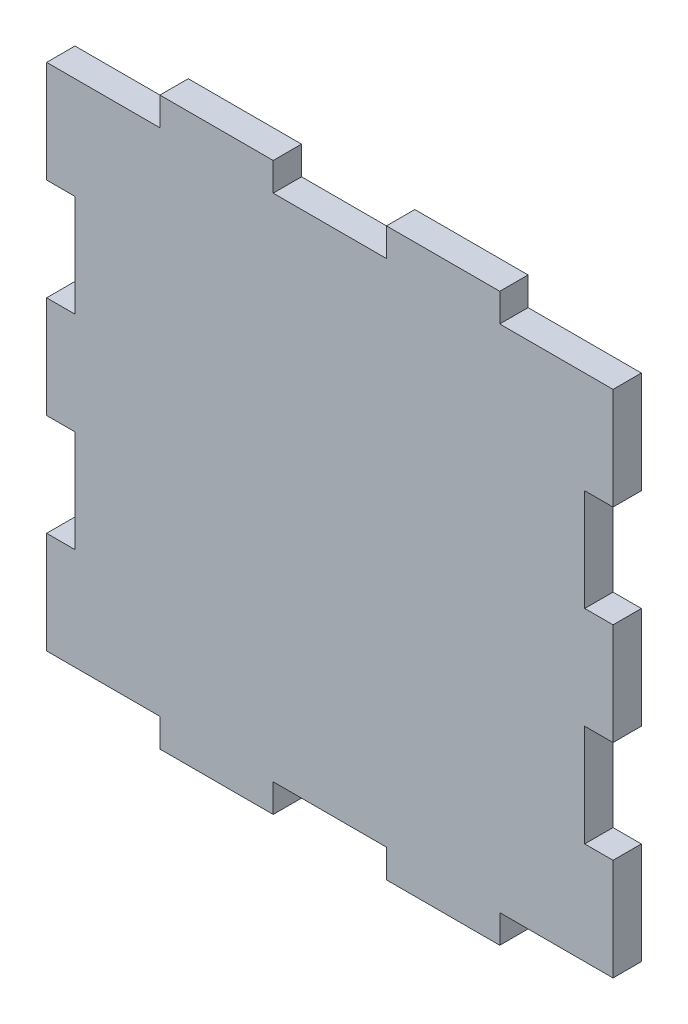
from build123d import *

# Parameters (mm, degrees)
ESQUISSE1_W             = 100
ESQUISSE1_H             = 90
BOSS_EXTRU_1_DEPTH      = 5
ESQUISSE2_OUTSIDE_W     = 128.926
ESQUISSE2_OUTSIDE_H     = 118.926
ENL_V_MAT_EXTRU_1_DEPTH = 5
ESQUISSE3_W             = 20
ESQUISSE3_H             = 5
BOSS_EXTRU_2_DEPTH      = 5


with BuildPart() as part:
    # Esquisse1 → Boss.-Extru.1 (new body)
    with BuildSketch(Plane.XY):
        with Locations((-50, -45)):
            Rectangle(ESQUISSE1_W, ESQUISSE1_H)
    extrude(amount=BOSS_EXTRU_1_DEPTH)

    # Esquisse2 outside → Enlèv. mat.-Extru.1 (cut)
    with BuildSketch(Plane.XY.offset(5)):
        with Locations((-50, -45)):
            Rectangle(ESQUISSE2_OUTSIDE_W, ESQUISSE2_OUTSIDE_H)
        Polygon((-100, 0), (-100, -18), (-95, -18), (-95, -36), (-100, -36), (-100, -54), (-95, -54), (-95, -72), (-100, -72), (-100, -90), (0, -90), (0, -72), (-5, -72), (-5, -54), (0, -54), (0, -36), (-5, -36), (-5, -18), (0, -18), (0, 0), align=None, mode=Mode.SUBTRACT)
    extrude(amount=-ENL_V_MAT_EXTRU_1_DEPTH, mode=Mode.SUBTRACT)

    # Esquisse3 → Boss.-Extru.2 (add)
    with BuildSketch(Plane.XY.offset(5)):
        with Locations((-70, 2.5)):
            Rectangle(ESQUISSE3_W, ESQUISSE3_H)
        with Locations((-30, 2.5)):
            Rectangle(ESQUISSE3_W, ESQUISSE3_H)
        with Locations((-70, -92.5)):
            Rectangle(ESQUISSE3_W, ESQUISSE3_H)
        with Locations((-30, -92.5)):
            Rectangle(ESQUISSE3_W, ESQUISSE3_H)
    extrude(amount=-BOSS_EXTRU_2_DEPTH)


solid = part.part
